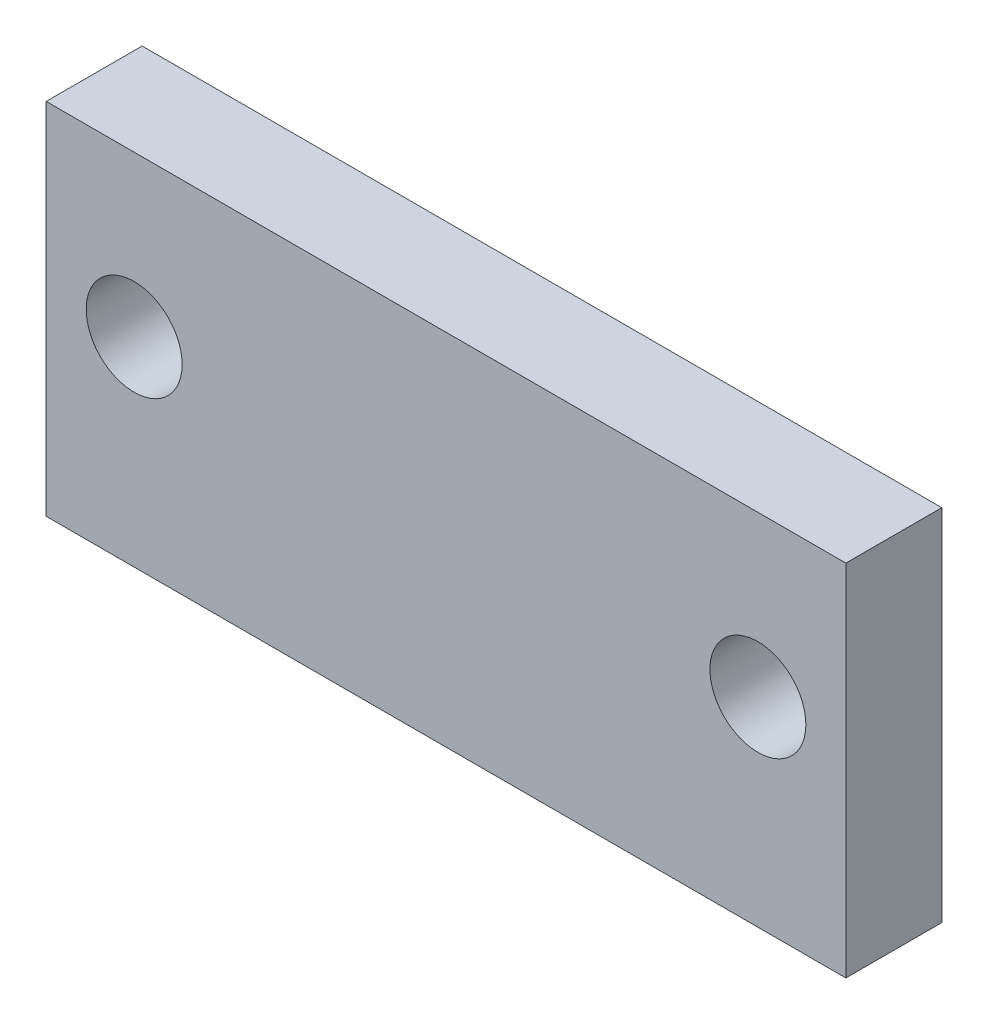
from build123d import *

# Parameters (mm, degrees)
SKETCH1_W           = 25
SKETCH1_H           = 11.23366013
BOSS_EXTRUDE1_DEPTH = 3
SKETCH2_R           = 1.5
CUT_EXTRUDE1_DEPTH  = 15.02849885


with BuildPart() as part:
    # Sketch1 → Boss-Extrude1 (new body)
    with BuildSketch(Plane.XY):
        Rectangle(SKETCH1_W, SKETCH1_H)
    extrude(amount=BOSS_EXTRUDE1_DEPTH)

    # Sketch2 → Cut-Extrude1 (cut, through all)
    with BuildSketch(Plane.XY.offset(3)):
        with Locations((-9.75, 0.616830065)):
            Circle(SKETCH2_R)
        with Locations((9.75, 0.616830065)):
            Circle(SKETCH2_R)
    extrude(amount=-CUT_EXTRUDE1_DEPTH, mode=Mode.SUBTRACT)


solid = part.part
